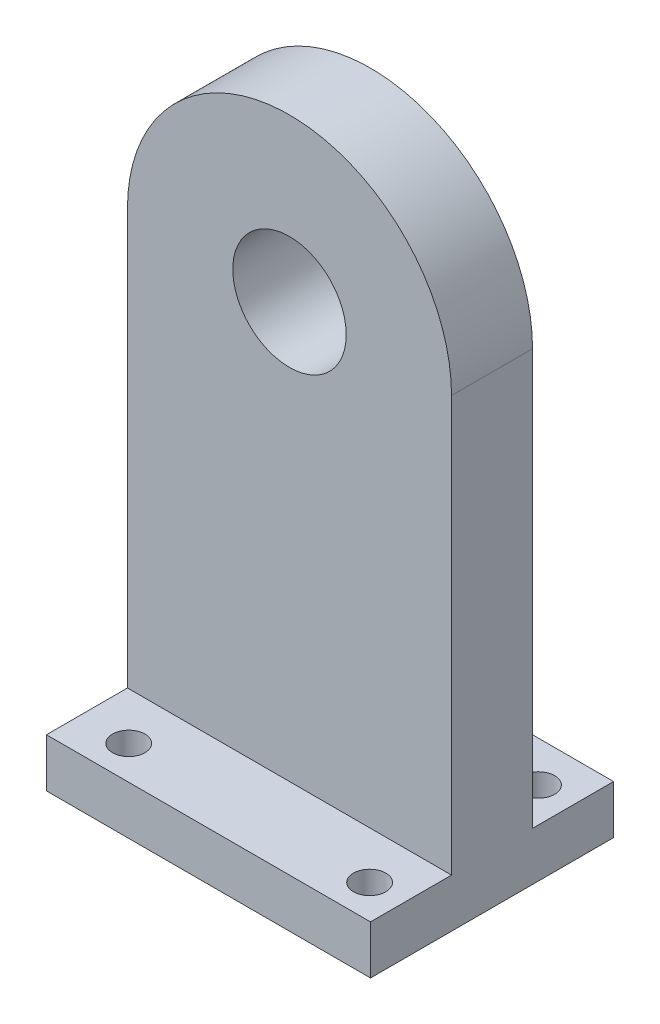
from build123d import *

# Parameters (mm, degrees)
BOSS_EXTRU_1_DEPTH      = 5
ESQUISSE2_R             = 3.5
ENL_V_MAT_EXTRU_1_DEPTH = 5
BOSS_EXTRU_2_DEPTH      = 5
BOSS_EXTRU_2_DEPTH_BACK = 10
ESQUISSE3_W             = 20
ESQUISSE3_H             = 3
ESQUISSE4_R             = 1
ENL_V_MAT_EXTRU_2_DEPTH = 5


with BuildPart() as part:
    # Esquisse1 → Boss.-Extru.1 (new body)
    with BuildSketch(Plane.XY):
        with BuildLine():
            Line((-10, -28.63), (-10, 0))
            ThreePointArc((-10, 0), (0, 10), (10, 0))
            Line((10, 0), (10, -28.63))
            Line((10, -28.63), (-10, -28.63))
        make_face()
    extrude(amount=BOSS_EXTRU_1_DEPTH)

    # Esquisse2 → Enlèv. mat.-Extru.1 (cut)
    with BuildSketch(Plane.XY.offset(5)):
        Circle(ESQUISSE2_R)
    extrude(amount=-ENL_V_MAT_EXTRU_1_DEPTH, mode=Mode.SUBTRACT)

    # Esquisse3 → Boss.-Extru.2 (add, two sides: drawn at the far end of the back side and taken through both)
    with BuildSketch(Plane.XY.offset(5).offset(-BOSS_EXTRU_2_DEPTH_BACK)):
        with Locations((0, -27.13)):
            Rectangle(ESQUISSE3_W, ESQUISSE3_H)
    extrude(amount=BOSS_EXTRU_2_DEPTH + BOSS_EXTRU_2_DEPTH_BACK)

    # Esquisse4 → Enlèv. mat.-Extru.2 (cut)
    with BuildSketch(Plane(origin=(0, -25.63, 0), x_dir=(1, 0, 0), z_dir=(0, 1, 0))):
        with Locations(Location((-7, -7.92068908, 0), (0, 0, 270))):
            Circle(ESQUISSE4_R)
        with Locations(Location((7.865355749, -7.92068908, 0), (0, 0, 270))):
            Circle(ESQUISSE4_R)
        with Locations(Location((7.865355749, 2.5, 0), (0, 0, 270))):
            Circle(ESQUISSE4_R)
        with Locations(Location((-7, 2.5, 0), (0, 0, 270))):
            Circle(ESQUISSE4_R)
    extrude(amount=-ENL_V_MAT_EXTRU_2_DEPTH, mode=Mode.SUBTRACT)


solid = part.part
